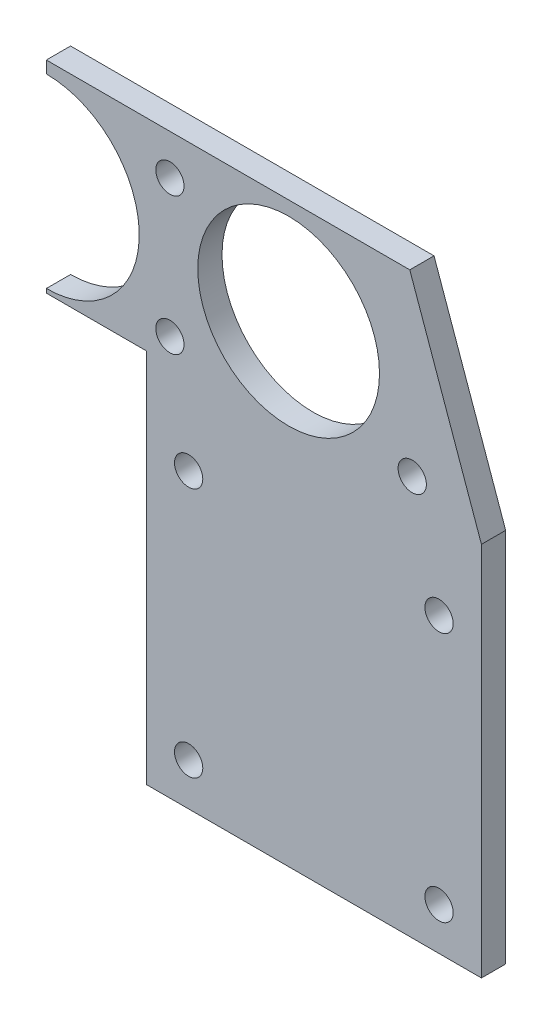
from build123d import *

# Parameters (mm, degrees)
SKETCH1_R           = 11.25
SKETCH1_R_2         = 1.75
BOSS_EXTRUDE1_DEPTH = 3


with BuildPart() as part:
    # Sketch1 → Boss-Extrude1 (new body)
    with BuildSketch(Plane.XY):
        with BuildLine():
            Line((-125.662997175, -15.687527708), (-84.162997175, -15.687527708))
            Line((-84.162997175, -15.687527708), (-84.162997175, 25.812472292))
            Line((-84.162997175, 25.812472292), (-84.162997175, 30.812472292))
            Line((-84.162997175, 30.812472292), (-93.033440026, 55.812472292))
            Line((-93.033440026, 55.812472292), (-138.033440026, 55.812472292))
            Line((-138.033440026, 55.812472292), (-138.033440026, 54.312472292))
            ThreePointArc((-138.033440026, 54.312472292), (-126.533440026, 42.812472292), (-138.033440026, 31.312472292))
            Line((-138.033440026, 31.312472292), (-138.033440026, 30.812472292))
            Line((-138.033440026, 30.812472292), (-125.662997175, 30.812472292))
            Line((-125.662997175, 30.812472292), (-125.662997175, 25.812472292))
            Line((-125.662997175, 25.812472292), (-125.662997175, -15.687527708))
        make_face()
        with Locations((-108.033440026, 42.812472292)):
            Circle(SKETCH1_R, mode=Mode.SUBTRACT)
        with Locations((-89.412997175, 20.562472292)):
            Circle(SKETCH1_R_2, mode=Mode.SUBTRACT)
        with Locations((-120.412997175, 20.562472292)):
            Circle(SKETCH1_R_2, mode=Mode.SUBTRACT)
        with Locations((-120.412997175, -10.437527708)):
            Circle(SKETCH1_R_2, mode=Mode.SUBTRACT)
        with Locations((-89.412997175, -10.437527708)):
            Circle(SKETCH1_R_2, mode=Mode.SUBTRACT)
        with Locations((-122.733440026, 50.812472292)):
            Circle(SKETCH1_R_2, mode=Mode.SUBTRACT)
        with Locations((-122.733440026, 33.812472292)):
            Circle(SKETCH1_R_2, mode=Mode.SUBTRACT)
        with Locations((-92.733440026, 33.812472292)):
            Circle(SKETCH1_R_2, mode=Mode.SUBTRACT)
    extrude(amount=BOSS_EXTRUDE1_DEPTH)


solid = part.part
